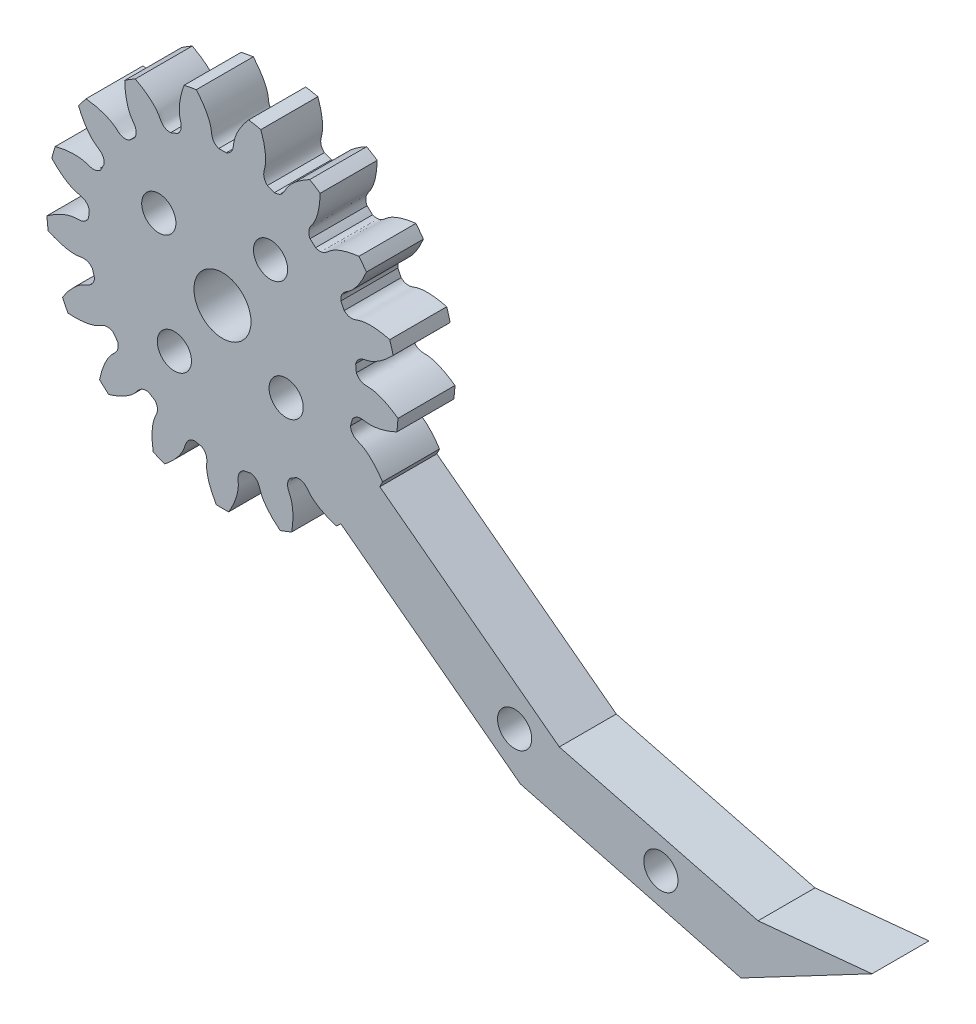
from build123d import *

# Parameters (mm, degrees)
SKETCH_1_R               = 15.4185
EXTRUDE_1_DEPTH          = 5
CUT_EXTRUDE_1_DEPTH      = 23.370969682
PATTERN_CIRCULAR_1_COUNT = 17
SKETCH_4_R               = 2.5
SKETCH_4_R_2             = 1.5
CUT_EXTRUDE_2_DEPTH      = 10
EXTRUDE_2_DEPTH          = 5
SKETCH_6_R               = 1.5
CUT_EXTRUDE_3_DEPTH      = 10


with BuildPart() as part:
    # 草图1 → 凸台-拉伸1 (new body)
    with BuildSketch(Plane.XY):
        Circle(SKETCH_1_R)
    extrude(amount=EXTRUDE_1_DEPTH)

    # 草图2 → 切除-拉伸1 (cut, through all)
    with BuildSketch(Plane.XY):
        with BuildLine():
            ThreePointArc((0.327348952, 11.762195723), (0, 11.76675), (-0.327348952, 11.762195723))
            add(Edge.make_bspline(
                [(-0.327348952, 11.762195723), (-1.019048819, 12.05048614), (-0.918935099, 12.586062159), (-1.035969996, 13.089209576), (-1.046795617, 13.131937416), (-1.05984903, 13.179440546), (-1.075319607, 13.231645995), (-1.093401755, 13.288473767), (-1.114285386, 13.349838413), (-1.138158687, 13.415648618), (-1.165207064, 13.485807407), (-1.195613266, 13.560212171), (-1.229557151, 13.63875475), (-1.26721556, 13.721321501), (-1.308762166, 13.807793383), (-1.354367329, 13.898046034), (-1.404197952, 13.991949858), (-1.458417341, 14.089370118), (-1.517185067, 14.19016702), (-1.58065683, 14.294195818), (-1.648984323, 14.401306911), (-1.722315103, 14.511345943), (-1.800792459, 14.624153912), (-1.884555287, 14.739567282), (-1.97373797, 14.857418089), (-2.068470251, 14.977534064), (-2.168877117, 15.099738747), (-2.275078688, 15.223851613), (-2.387190097, 15.349688191), (-2.505321389, 15.477060201), (-2.62957741, 15.605775673), (-2.760057705, 15.73563909), (-2.896856419, 15.866451519), (-3.040062202, 15.998010749), (-3.189758115, 16.130111435), (-3.346021539, 16.262545238), (-3.508924092, 16.395100973), (-3.678531546, 16.527564754), (-3.854903748, 16.659720146), (-4.038094542, 16.791348319), (-4.22815171, 16.922228195), (-4.425116859, 17.052136614), (-4.699918513, 17.225597756), (-4.912134312, 17.350723651), (-5.056693187, 17.432187129)],
                knots=[0, 0, 0, 0, 0.193882922, 0.199023975, 0.204850501, 0.211362501, 0.218559975, 0.226442923, 0.235011345, 0.24426524, 0.254204608, 0.264829451, 0.276139767, 0.288135557, 0.300816821, 0.314183558, 0.328235769, 0.342973453, 0.358396612, 0.374505244, 0.39129935, 0.408778929, 0.426943982, 0.445794509, 0.46533051, 0.485551984, 0.506458932, 0.528051354, 0.550329249, 0.573292619, 0.596941461, 0.621275778, 0.646295568, 0.672000832, 0.69839157, 0.725467781, 0.753229466, 0.781676625, 0.810809257, 0.840627364, 0.871130943, 0.902319997, 0.934194524, 1, 1, 1, 1], degree=3))
            ThreePointArc((-5.056693187, 17.432187129), (0, 18.150793208), (5.056693187, 17.432187129))
            add(Edge.make_bspline(
                [(0.327348952, 11.762195723), (1.019048819, 12.05048614), (0.918935099, 12.586062159), (1.035969996, 13.089209576), (1.046795617, 13.131937416), (1.05984903, 13.179440546), (1.075319607, 13.231645995), (1.093401755, 13.288473767), (1.114285386, 13.349838413), (1.138158687, 13.415648618), (1.165207064, 13.485807407), (1.195613266, 13.560212171), (1.229557151, 13.63875475), (1.26721556, 13.721321501), (1.308762166, 13.807793383), (1.354367329, 13.898046034), (1.404197952, 13.991949858), (1.458417341, 14.089370118), (1.517185067, 14.19016702), (1.58065683, 14.294195818), (1.648984323, 14.401306911), (1.722315103, 14.511345943), (1.800792459, 14.624153912), (1.884555287, 14.739567282), (1.97373797, 14.857418089), (2.068470251, 14.977534064), (2.168877117, 15.099738747), (2.275078688, 15.223851613), (2.387190097, 15.349688191), (2.505321389, 15.477060201), (2.62957741, 15.605775673), (2.760057705, 15.73563909), (2.896856419, 15.866451519), (3.040062202, 15.998010749), (3.189758115, 16.130111435), (3.346021539, 16.262545238), (3.508924092, 16.395100973), (3.678531546, 16.527564754), (3.854903748, 16.659720146), (4.038094542, 16.791348319), (4.22815171, 16.922228195), (4.425116859, 17.052136614), (4.699918513, 17.225597756), (4.912134312, 17.350723651), (5.056693187, 17.432187129)],
                knots=[0, 0, 0, 0, 0.193882922, 0.199023975, 0.204850501, 0.211362501, 0.218559975, 0.226442923, 0.235011345, 0.24426524, 0.254204608, 0.264829451, 0.276139767, 0.288135557, 0.300816821, 0.314183558, 0.328235769, 0.342973453, 0.358396612, 0.374505244, 0.39129935, 0.408778929, 0.426943982, 0.445794509, 0.46533051, 0.485551984, 0.506458932, 0.528051354, 0.550329249, 0.573292619, 0.596941461, 0.621275778, 0.646295568, 0.672000832, 0.69839157, 0.725467781, 0.753229466, 0.781676625, 0.810809257, 0.840627364, 0.871130943, 0.902319997, 0.934194524, 1, 1, 1, 1], degree=3))
        make_face()
    cut_extrude_1 = extrude(amount=CUT_EXTRUDE_1_DEPTH, mode=Mode.SUBTRACT)

    # 阵列(圆周)1: 切除-拉伸1 ×17 about axis
    pattern_circular_1_axis = Axis((0, 0, 5), (0, 0, -1))
    for i in range(1, PATTERN_CIRCULAR_1_COUNT):
        add(cut_extrude_1.rotate(pattern_circular_1_axis, i * 360 / PATTERN_CIRCULAR_1_COUNT), mode=Mode.SUBTRACT)

    # 草图4 → 切除-拉伸2 (cut)
    with BuildSketch(Plane.XY.offset(5)):
        Circle(SKETCH_4_R)
        with Locations((-5.586120591, 4.218442455)):
            Circle(SKETCH_4_R_2)
        with Locations((4.218442455, 5.586120591)):
            Circle(SKETCH_4_R_2)
        with Locations((5.586120591, -4.218442455)):
            Circle(SKETCH_4_R_2)
        with Locations((-4.218442455, -5.586120591)):
            Circle(SKETCH_4_R_2)
    extrude(amount=-CUT_EXTRUDE_2_DEPTH, mode=Mode.SUBTRACT)

    # 草图5 → 凸台-拉伸2 (add)
    with BuildSketch(Plane.XY.offset(5)):
        Polygon((10.387376282, -11.39440899), (26.131596824, -23.283892446), (45.479531415, -28.349208533), (56.976883263, -22.2820098), (46.976883263, -23.253716812), (29.54629575, -18.762100295), (13.802075208, -6.872616839), (8.676324347, -4.190074816), (6.965272413, -7.440106755), align=None)
    extrude(amount=-EXTRUDE_2_DEPTH)

    # 草图6 → 切除-拉伸3 (cut)
    with BuildSketch(Plane.XY.offset(5)):
        with Locations((38.455725857, -23.717140639)):
            Circle(SKETCH_6_R)
        with Locations((25.628118392, -19.349519459)):
            Circle(SKETCH_6_R)
    extrude(amount=-CUT_EXTRUDE_3_DEPTH, mode=Mode.SUBTRACT)


solid = part.part
